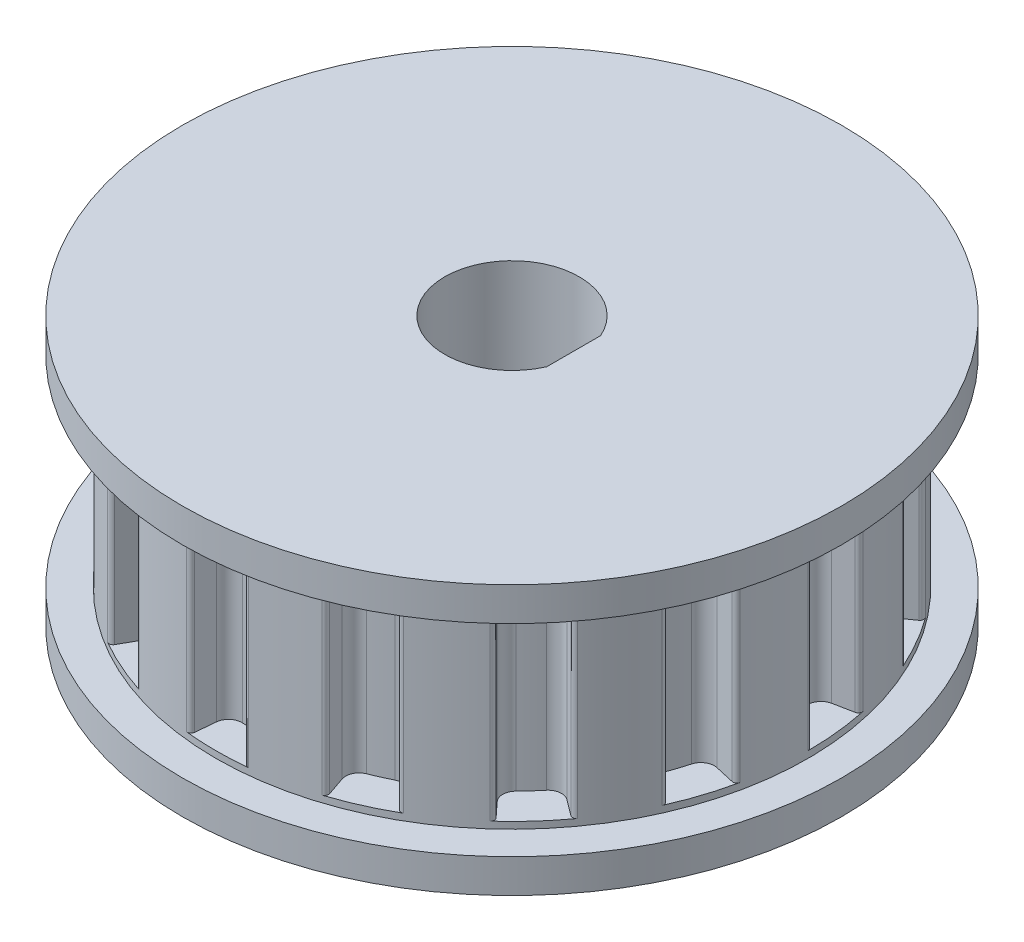
from build123d import *

# Parameters (mm, degrees)
CUT_EXTRUDE2_DEPTH       = 3.5
FILLET1_R                = 0.15
FILLET4_R                = 0.5
CIRPATTERN1_COUNT        = 15
FILLET1_OF_CIRPATTERN1_R = 0.15
FILLET4_OF_CIRPATTERN1_R = 0.5
CUT_EXTRUDE3_DEPTH       = 21.003124756


with BuildPart() as part:
    # Sketch4 → Revolve1 (revolve)
    with BuildSketch(Plane(origin=(0, 0, 0), x_dir=(0, 0, -1), z_dir=(1, 0, 0)), mode=Mode.PRIVATE) as revolve1_sk:
        Polygon((0, -5), (12.25, -5), (12.25, -3.75), (11, -3.75), (11, 3.75), (12.25, 3.75), (12.25, 5), (0, 5), align=None)
    revolve(revolve1_sk.sketch.rotate(Axis((0, 5, 0), (0, -1, 0)), 180), axis=Axis((0, 5, 0), (0, -1, 0)))

    # Sketch5 → Cut-Extrude2 (cut, symmetric)
    with BuildSketch(Plane(origin=(0, 0, 0), x_dir=(1, 0, 0), z_dir=(0, 1, 0))):
        with BuildLine():
            Line((0.998623159, -10.954576751), (0.873341344, -9.580275304))
            ThreePointArc((0.873341344, -9.580275304), (0, -9.62), (-0.873341344, -9.580275304))
            Line((-0.873341344, -9.580275304), (-0.998623159, -10.954576751))
            ThreePointArc((-0.998623159, -10.954576751), (0, -11), (0.998623159, -10.954576751))
        make_face()
    cut_extrude2 = extrude(amount=CUT_EXTRUDE2_DEPTH, both=True, mode=Mode.SUBTRACT)

    # Fillet1
    fillet1_edges = [part.edges().sort_by_distance(p)[0] for p in [
        (0.998623159, 0, 10.954576751),
        (-0.998623159, 0, 10.954576751),
    ]]
    fillet(fillet1_edges, radius=FILLET1_R)

    # Fillet4
    fillet4_edges = [part.edges().sort_by_distance(p)[0] for p in [
        (-0.873341344, 0, 9.580275304),
        (0.873341344, 0, 9.580275304),
    ]]
    fillet(fillet4_edges, radius=FILLET4_R)

    # CirPattern1: Cut-Extrude2 ×15 about axis
    cirpattern1_axis = Axis((0, 0, 0), (0, 1, 0))
    for i in range(1, CIRPATTERN1_COUNT):
        add(cut_extrude2.rotate(cirpattern1_axis, i * 360 / CIRPATTERN1_COUNT), mode=Mode.SUBTRACT)

    # Fillet1 of CirPattern1
    fillet1_of_cirpattern1_edges = [part.edges().sort_by_distance(p)[0] for p in [
        (5.367915424, 0, 9.6013272),
        (3.543340123, 0, 10.413680462),
        (8.809046347, 0, 6.587920951),
        (7.472627708, 0, 8.072164217),
        (10.727013129, 0, 2.43540332),
        (10.109830075, 0, 4.334897444),
        (10.790181889, 0, -2.13821767),
        (10.998950977, 0, -0.151912477),
        (8.987630175, 0, -6.3421214),
        (9.986253333, 0, -4.612455351),
        (5.631035553, 0, -9.449414723),
        (7.246841765, 0, -8.275462792),
        (1.300783728, 0, -10.922818395),
        (3.254385421, 0, -10.507567536),
        (-3.254385421, 0, -10.507567536),
        (-1.300783728, 0, -10.922818395),
        (-7.246841765, 0, -8.275462792),
        (-5.631035553, 0, -9.449414723),
        (-9.986253333, 0, -4.612455351),
        (-8.987630175, 0, -6.3421214),
        (-10.998950977, 0, -0.151912477),
        (-10.790181889, 0, -2.13821767),
        (-10.109830075, 0, 4.334897444),
        (-10.727013129, 0, 2.43540332),
        (-7.472627708, 0, 8.072164217),
        (-8.809046347, 0, 6.587920951),
        (-3.543340123, 0, 10.413680462),
        (-5.367915424, 0, 9.6013272),
    ]]
    fillet(fillet1_of_cirpattern1_edges, radius=FILLET1_OF_CIRPATTERN1_R)

    # Fillet4 of CirPattern1
    fillet4_of_cirpattern1_edges = [part.edges().sort_by_distance(p)[0] for p in [
        (3.098811999, 0, 9.107236913),
        (4.694486035, 0, 8.39679706),
        (6.535152595, 0, 7.059474524),
        (7.703911442, 0, 5.761436322),
        (8.841505938, 0, 3.791064856),
        (9.381260573, 0, 2.129870903),
        (9.619082582, 0, -0.132854366),
        (9.436504525, 0, -1.869968544),
        (8.73343246, 0, -4.033801862),
        (7.860091116, 0, -5.546473442),
        (6.337692526, 0, -7.237268369),
        (4.924596547, 0, -8.263942694),
        (2.846107977, 0, -9.189345427),
        (1.137594497, 0, -9.552501178),
        (-1.137594497, 0, -9.552501178),
        (-2.846107977, 0, -9.189345427),
        (-4.924596547, 0, -8.263942694),
        (-6.337692526, 0, -7.237268369),
        (-7.860091116, 0, -5.546473442),
        (-8.73343246, 0, -4.033801862),
        (-9.436504525, 0, -1.869968544),
        (-9.619082582, 0, -0.132854366),
        (-9.381260573, 0, 2.129870903),
        (-8.841505938, 0, 3.791064856),
        (-7.703911442, 0, 5.761436322),
        (-6.535152595, 0, 7.059474524),
        (-4.694486035, 0, 8.39679706),
        (-3.098811999, 0, 9.107236913),
    ]]
    fillet(fillet4_of_cirpattern1_edges, radius=FILLET4_OF_CIRPATTERN1_R)

    # Sketch6 → Cut-Extrude3 (cut, through all)
    with BuildSketch(Plane(origin=(0, 5, 0), x_dir=(1, 0, 0), z_dir=(0, 1, 0))):
        with BuildLine():
            Line((2.291287847, 1), (2.291287847, -1))
            ThreePointArc((2.291287847, -1), (-2.5, 0), (2.291287847, 1))
        make_face()
    extrude(amount=-CUT_EXTRUDE3_DEPTH, mode=Mode.SUBTRACT)


solid = part.part
